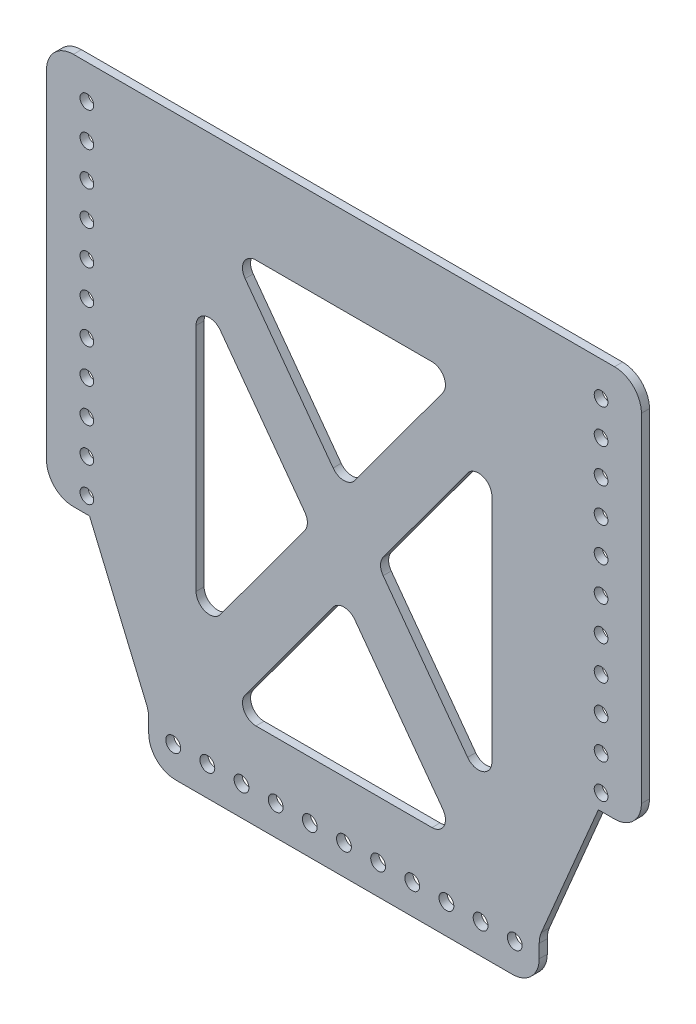
from build123d import *

# Parameters (mm, degrees)
SKETCH_1_W          = 221.2
SKETCH_1_H          = 217.66
SKETCH_1_R          = 2.757404821
EXTRUDE_1_DEPTH     = 3
SKETCH_2_R          = 2.55
CUT_EXTRUDE_1_DEPTH = 10
CUT_EXTRUDE_2_DEPTH = 10
FILLET_1_R          = 10
CUT_EXTRUDE_3_DEPTH = 10
FILLET_2_R          = 5


with BuildPart() as part:
    # 草图1 → 凸台-拉伸1 (new body)
    with BuildSketch(Plane.XY):
        with Locations((39.694458169, -239.311229018)):
            Rectangle(SKETCH_1_W, SKETCH_1_H)
        with Locations((-49.205541831, -334.072837073)):
            Circle(SKETCH_1_R, mode=Mode.SUBTRACT)
        with Locations((-36.505541831, -334.072837073)):
            Circle(SKETCH_1_R, mode=Mode.SUBTRACT)
        with Locations((-23.805541831, -334.072837073)):
            Circle(SKETCH_1_R, mode=Mode.SUBTRACT)
        with Locations((-11.105541831, -334.072837073)):
            Circle(SKETCH_1_R, mode=Mode.SUBTRACT)
        with Locations((1.594458169, -334.072837073)):
            Circle(SKETCH_1_R, mode=Mode.SUBTRACT)
        with Locations((14.294458169, -334.072837073)):
            Circle(SKETCH_1_R, mode=Mode.SUBTRACT)
        with Locations((26.994458169, -334.072837073)):
            Circle(SKETCH_1_R, mode=Mode.SUBTRACT)
        with Locations((39.694458169, -334.072837073)):
            Circle(SKETCH_1_R, mode=Mode.SUBTRACT)
        with Locations((52.394458169, -334.072837073)):
            Circle(SKETCH_1_R, mode=Mode.SUBTRACT)
        with Locations((65.094458169, -334.072837073)):
            Circle(SKETCH_1_R, mode=Mode.SUBTRACT)
        with Locations((77.794458169, -334.072837073)):
            Circle(SKETCH_1_R, mode=Mode.SUBTRACT)
        with Locations((90.494458169, -334.072837073)):
            Circle(SKETCH_1_R, mode=Mode.SUBTRACT)
        with Locations((103.194458169, -334.072837073)):
            Circle(SKETCH_1_R, mode=Mode.SUBTRACT)
        with Locations((115.894458169, -334.072837073)):
            Circle(SKETCH_1_R, mode=Mode.SUBTRACT)
        with Locations((-61.905541831, -334.072837073)):
            Circle(SKETCH_1_R, mode=Mode.SUBTRACT)
        with Locations((128.594458169, -334.072837073)):
            Circle(SKETCH_1_R, mode=Mode.SUBTRACT)
        with Locations((141.294458169, -334.072837073)):
            Circle(SKETCH_1_R, mode=Mode.SUBTRACT)
    extrude(amount=EXTRUDE_1_DEPTH)

    # 草图2 → 切除-拉伸1 (cut)
    with BuildSketch(Plane.XY.offset(3)):
        with Locations((-55.905541831, -143.181229018)):
            Circle(SKETCH_2_R)
        with Locations((-55.905541831, -155.881229018)):
            Circle(SKETCH_2_R)
        with Locations((-55.905541831, -168.581229018)):
            Circle(SKETCH_2_R)
        with Locations((-55.905541831, -181.281229018)):
            Circle(SKETCH_2_R)
        with Locations((-55.905541831, -193.981229018)):
            Circle(SKETCH_2_R)
        with Locations((-55.905541831, -206.681229018)):
            Circle(SKETCH_2_R)
        with Locations((-55.905541831, -219.381229018)):
            Circle(SKETCH_2_R)
        with Locations((-55.905541831, -232.081229018)):
            Circle(SKETCH_2_R)
        with Locations((-55.905541831, -244.781229018)):
            Circle(SKETCH_2_R)
        with Locations((-55.905541831, -257.481229018)):
            Circle(SKETCH_2_R)
        with Locations((-55.905541831, -270.181229018)):
            Circle(SKETCH_2_R)
        with Locations((-55.905541831, -282.881229018)):
            Circle(SKETCH_2_R)
        with Locations((-55.905541831, -295.581229018)):
            Circle(SKETCH_2_R)
        with Locations((-55.905541831, -308.281229018)):
            Circle(SKETCH_2_R)
        with Locations((-55.905541831, -320.981229018)):
            Circle(SKETCH_2_R)
        with Locations((135.294458169, -320.981229018)):
            Circle(SKETCH_2_R)
        with Locations((135.294458169, -308.281229018)):
            Circle(SKETCH_2_R)
        with Locations((135.294458169, -295.581229018)):
            Circle(SKETCH_2_R)
        with Locations((135.294458169, -282.881229018)):
            Circle(SKETCH_2_R)
        with Locations((135.294458169, -270.181229018)):
            Circle(SKETCH_2_R)
        with Locations((135.294458169, -257.481229018)):
            Circle(SKETCH_2_R)
        with Locations((135.294458169, -244.781229018)):
            Circle(SKETCH_2_R)
        with Locations((135.294458169, -232.081229018)):
            Circle(SKETCH_2_R)
        with Locations((135.294458169, -219.381229018)):
            Circle(SKETCH_2_R)
        with Locations((135.294458169, -206.681229018)):
            Circle(SKETCH_2_R)
        with Locations((135.294458169, -193.981229018)):
            Circle(SKETCH_2_R)
        with Locations((135.294458169, -181.281229018)):
            Circle(SKETCH_2_R)
        with Locations((135.294458169, -168.581229018)):
            Circle(SKETCH_2_R)
        with Locations((135.294458169, -155.881229018)):
            Circle(SKETCH_2_R)
        with Locations((135.294458169, -143.181229018)):
            Circle(SKETCH_2_R)
    extrude(amount=-CUT_EXTRUDE_1_DEPTH, mode=Mode.SUBTRACT)

    # 草图3 → 切除-拉伸2 (cut)
    with BuildSketch(Plane.XY.offset(3)):
        Polygon((112.294458169, -345.141229018), (112.294458169, -328.141229018), (134.294458169, -276.141229018), (150.294458169, -276.141229018), (150.294458169, -348.141229018), (-70.905541831, -348.141229018), (-70.905541831, -276.141229018), (-54.905541831, -276.141229018), (-32.905541831, -328.141229018), (-32.905541831, -345.141229018), align=None)
    extrude(amount=-CUT_EXTRUDE_2_DEPTH, mode=Mode.SUBTRACT)

    # 圆角1
    fillet_1_edges = [part.edges().sort_by_distance(p)[0] for p in [
        (150.294458169, -276.141229018, 1.5),
        (112.294458169, -328.141229018, 1.5),
        (-32.905541831, -328.141229018, 1.5),
        (-32.905541831, -345.141229018, 1.5),
        (112.294458169, -345.141229018, 1.5),
        (-70.905541831, -276.141229018, 1.5),
        (-70.905541831, -130.481229018, 1.5),
        (150.294458169, -130.481229018, 1.5),
    ]]
    fillet(fillet_1_edges, radius=FILLET_1_R)

    # 草图4 → 切除-拉伸3 (cut)
    with BuildSketch(Plane.XY.offset(3)):
        Polygon((-15.305541831, -179.721297416), (27.293741344, -237.811229018), (-15.305541831, -295.90116062), align=None)
        Polygon((-2.904825006, -162.811229018), (82.293741344, -162.811229018), (39.694458169, -220.90116062), align=None)
        Polygon((-2.904825006, -312.811229018), (82.293741344, -312.811229018), (39.694458169, -254.721297416), align=None)
        Polygon((94.694458169, -179.721297416), (94.694458169, -295.90116062), (52.095174994, -237.811229018), align=None)
    extrude(amount=-CUT_EXTRUDE_3_DEPTH, mode=Mode.SUBTRACT)

    # 圆角2
    fillet_2_edges = [part.edges().sort_by_distance(p)[0] for p in [
        (-2.904825006, -312.811229018, 1.5),
        (39.694458169, -254.721297416, 1.5),
        (82.293741344, -312.811229018, 1.5),
        (-15.305541831, -295.90116062, 1.5),
        (-15.305541831, -179.721297416, 1.5),
        (27.293741344, -237.811229018, 1.5),
        (94.694458169, -295.90116062, 1.5),
        (52.095174994, -237.811229018, 1.5),
        (94.694458169, -179.721297416, 1.5),
        (39.694458169, -220.90116062, 1.5),
        (-2.904825006, -162.811229018, 1.5),
        (82.293741344, -162.811229018, 1.5),
    ]]
    fillet(fillet_2_edges, radius=FILLET_2_R)


solid = part.part
